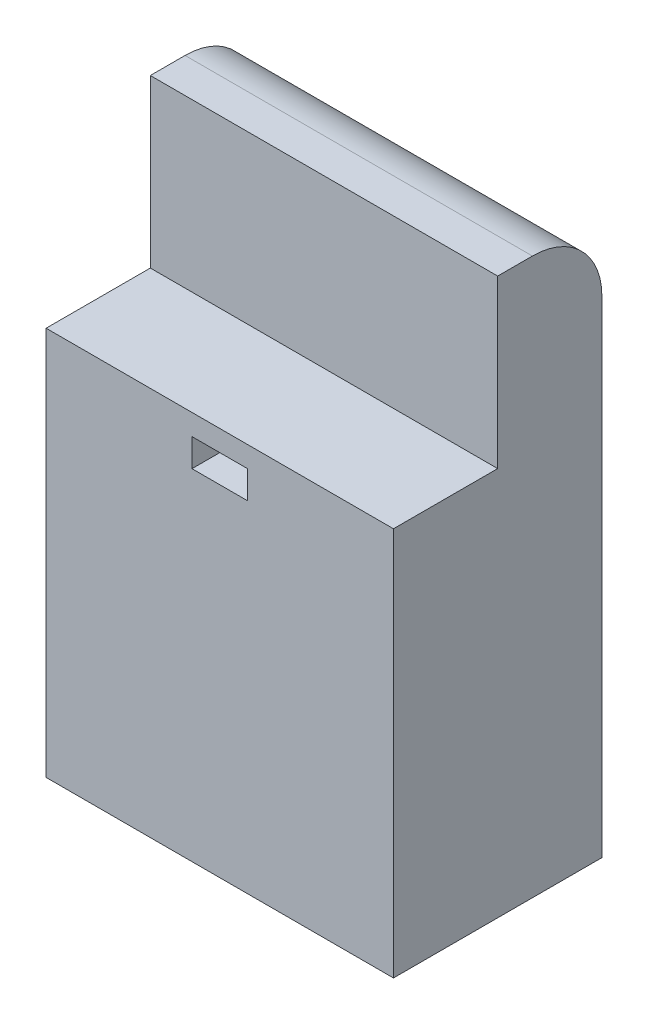
from build123d import *

# Parameters (mm, degrees)
SKIZZE1_W                       = 25
SKIZZE1_H                       = 15
AUFSATZ_LINEAR_AUSTRAGEN1_DEPTH = 40
SKIZZE2_W                       = 25
SKIZZE2_H                       = 7.5
SCHNITT_LINEAR_AUSTRAGEN1_DEPTH = 12
VERRUNDUNG1_R                   = 5
SKIZZE3_W                       = 4
SKIZZE3_H                       = 2
SCHNITT_LINEAR_AUSTRAGEN2_DEPTH = 45.511234537


with BuildPart() as part:
    # Skizze1 → Aufsatz-Linear austragen1 (new body)
    with BuildSketch(Plane(origin=(0, 0, 0), x_dir=(1, 0, 0), z_dir=(0, 1, 0))):
        Rectangle(SKIZZE1_W, SKIZZE1_H)
    extrude(amount=AUFSATZ_LINEAR_AUSTRAGEN1_DEPTH)

    # Skizze2 → Schnitt-Linear austragen1 (cut)
    with BuildSketch(Plane(origin=(0, 40, 0), x_dir=(1, 0, 0), z_dir=(0, 1, 0))):
        with Locations((0, -3.75)):
            Rectangle(SKIZZE2_W, SKIZZE2_H)
    extrude(amount=-SCHNITT_LINEAR_AUSTRAGEN1_DEPTH, mode=Mode.SUBTRACT)

    # Verrundung1
    verrundung1_edges = [part.edges().sort_by_distance(p)[0] for p in [
        (0, 40, -7.5),
    ]]
    fillet(verrundung1_edges, radius=VERRUNDUNG1_R)

    # Skizze3 → Schnitt-Linear austragen2 (cut, through all)
    with BuildSketch(Plane.XY.offset(7.5)):
        with Locations((0, 25.494720236)):
            Rectangle(SKIZZE3_W, SKIZZE3_H)
    extrude(amount=-SCHNITT_LINEAR_AUSTRAGEN2_DEPTH, mode=Mode.SUBTRACT)


solid = part.part
